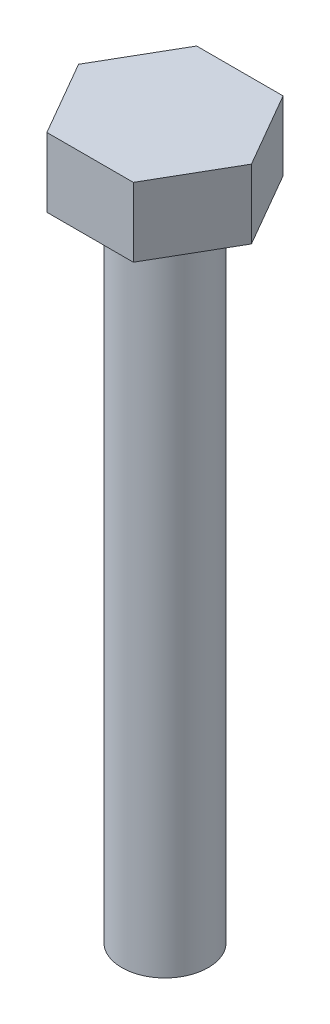
from build123d import *

# Parameters (mm, degrees)
ESQUISSE1_R        = 5
BOSS_EXTRU_1_DEPTH = 75
BOSS_EXTRU_2_DEPTH = 8


with BuildPart() as part:
    # Esquisse1 → Boss.-Extru.1 (new body)
    with BuildSketch(Plane(origin=(0, 0, 0), x_dir=(1, 0, 0), z_dir=(0, 1, 0))):
        with Locations(Location((0, 0, 0), (0, 0, 270))):
            Circle(ESQUISSE1_R)
    extrude(amount=BOSS_EXTRU_1_DEPTH)

    # Esquisse2 → Boss.-Extru.2 (add)
    with BuildSketch(Plane(origin=(0, 75, 0), x_dir=(1, 0, 0), z_dir=(0, 1, 0))):
        Polygon((-5, 8.660254038), (5, 8.660254038), (10, 0), (5, -8.660254038), (-5, -8.660254038), (-10, 0), align=None)
    extrude(amount=BOSS_EXTRU_2_DEPTH)


solid = part.part
